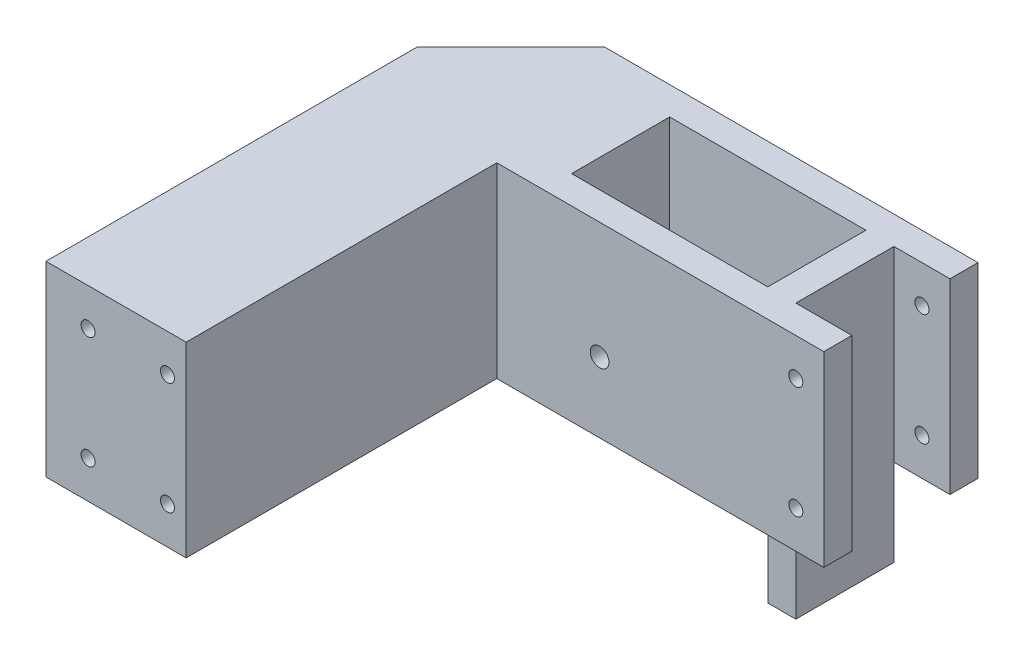
from build123d import *

# Parameters (mm, degrees)
EXTRUDE_1_DEPTH             = 40
SKETCH_8_R                  = 1.5
CUT_EXTRUDE_2_DEPTH         = 96.336247042
SKETCH_12_W                 = 30
SKETCH_12_H                 = 40
SKETCH_12_R                 = 1.5
EXTRUDE_7_DEPTH             = 66.5
EXTRUDE_7_DIRECTION_2_REACH = 97.336
CUT_EXTRUDE_3_DEPTH         = 112.45514793
CUT_EXTRUDE_START           = -50
SKETCH_15_R                 = 3.5
CUT_EXTRUDE_4_DEPTH         = 84.791815893
EXTRUDE_START               = -58.6
SKETCH_16_W                 = 6
SKETCH_16_H                 = 21
EXTRUDE_9_DEPTH             = 58.6
SKETCH_17_R                 = 2
CUT_EXTRUDE_5_DEPTH         = 112.45514793


with BuildPart() as part:
    # 草图1 → 凸台-拉伸1 (new body)
    with BuildSketch(Plane(origin=(0, 0, 0), x_dir=(1, 0, 0), z_dir=(0, 1, 0))):
        Polygon((0, 0), (80, 0), (80, 6), (20, 6), (20, 27), (80, 27), (80, 33), (0, 33), align=None)
    extrude(amount=EXTRUDE_1_DEPTH)

    # 草图8 → 切除-拉伸2 (cut, through all)
    with BuildSketch(Plane(origin=(0, 0, -33), x_dir=(-1, 0, 0), z_dir=(0, 0, -1))):
        with Locations((-74, 8)):
            Circle(SKETCH_8_R)
        with Locations((-74, 32)):
            Circle(SKETCH_8_R)
        with Locations((-6, 32)):
            Circle(SKETCH_8_R)
        with Locations((-6, 8)):
            Circle(SKETCH_8_R)
    extrude(amount=-CUT_EXTRUDE_2_DEPTH, mode=Mode.SUBTRACT)

    # 草图12 → 凸台-拉伸7 (add)
    with BuildSketch(Plane.XY):
        with Locations((-5, 20)):
            Rectangle(SKETCH_12_W, SKETCH_12_H)
        with Locations((-11, 32)):
            Circle(SKETCH_12_R, mode=Mode.SUBTRACT)
        with Locations((-11, 8)):
            Circle(SKETCH_12_R, mode=Mode.SUBTRACT)
        with Locations(Location((6, 8, 0), (0, 0, 180))):
            Circle(SKETCH_12_R, mode=Mode.SUBTRACT)
        with Locations(Location((6, 32, 0), (0, 0, 180))):
            Circle(SKETCH_12_R, mode=Mode.SUBTRACT)
    extrude(amount=EXTRUDE_7_DEPTH)

    # 凸台-拉伸7 direction 2: up to this face of the body (flat: up to its plane)
    extrude_7_direction_2_end = Plane(part.part.faces().sort_by_distance((40, 20, -33))[0])
    # 草图12 → 凸台-拉伸7 direction 2 (add, up to the picked face)
    with BuildSketch(Plane.XY, mode=Mode.PRIVATE) as extrude_7_direction_2_sk1:
        with Locations((-5, 20)):
            Rectangle(SKETCH_12_W, SKETCH_12_H)
        with Locations((-11, 32)):
            Circle(SKETCH_12_R, mode=Mode.SUBTRACT)
        with Locations((-11, 8)):
            Circle(SKETCH_12_R, mode=Mode.SUBTRACT)
        with Locations(Location((6, 8, 0), (0, 0, 180))):
            Circle(SKETCH_12_R, mode=Mode.SUBTRACT)
        with Locations(Location((6, 32, 0), (0, 0, 180))):
            Circle(SKETCH_12_R, mode=Mode.SUBTRACT)
    extrude_7_direction_2_tool1 = split(extrude(extrude_7_direction_2_sk1.sketch, amount=-EXTRUDE_7_DIRECTION_2_REACH, mode=Mode.PRIVATE), bisect_by=extrude_7_direction_2_end, keep=Keep.BOTH, mode=Mode.PRIVATE)
    add(extrude_7_direction_2_tool1.solids().sort_by(Axis((-5.060326, 20, 0), (0, 0, -1)))[0])

    # 草图14 → 切除-拉伸3 (cut, through all)
    with BuildSketch(Plane(origin=(0, 40, 0), x_dir=(1, 0, 0), z_dir=(0, 1, 0))):
        Polygon((-20, 33), (0, 33), (-20, 13), align=None)
    extrude(amount=-CUT_EXTRUDE_3_DEPTH, mode=Mode.SUBTRACT)

    # 草图15 → 切除-拉伸4 (cut, through all)
    with BuildSketch(Plane.XY.offset(66.5).offset(CUT_EXTRUDE_START)):
        with Locations((-11, 32)):
            Circle(SKETCH_15_R)
        with Locations((-11, 8)):
            Circle(SKETCH_15_R)
    extrude(amount=-CUT_EXTRUDE_4_DEPTH, mode=Mode.SUBTRACT)

    # 草图16 → 凸台-拉伸9 (add)
    with BuildSketch(Plane(origin=(0, 40, 0), x_dir=(1, 0, 0), z_dir=(0, 1, 0)).offset(EXTRUDE_START)):
        with Locations((65, 16.5)):
            Rectangle(SKETCH_16_W, SKETCH_16_H)
    extrude(amount=EXTRUDE_9_DEPTH)

    # 草图17 → 切除-拉伸5 (cut, through all)
    with BuildSketch(Plane.XY):
        with Locations((32, 15)):
            Circle(SKETCH_17_R)
    extrude(amount=-CUT_EXTRUDE_5_DEPTH, mode=Mode.SUBTRACT)


solid = part.part
